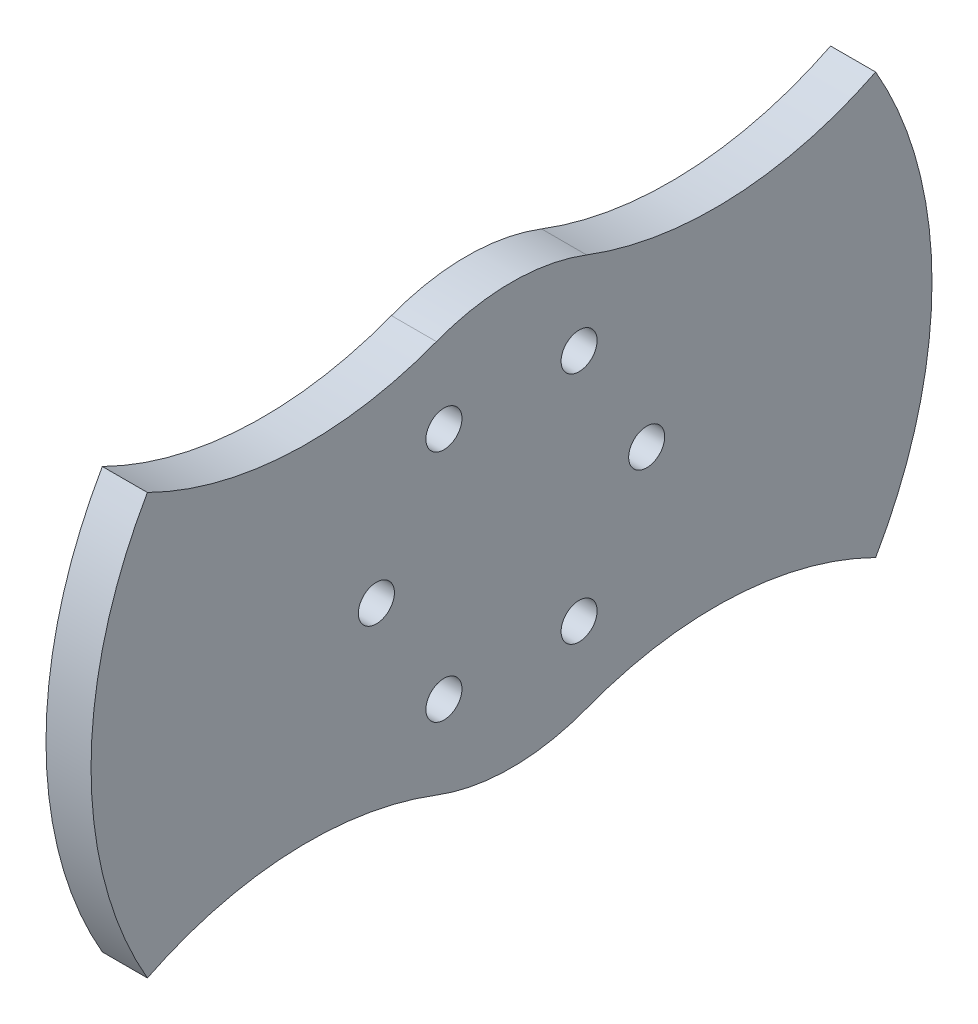
from build123d import *

# Parameters (mm, degrees)
SKETCH1_R            = 44.45
BOSS_EXTRUDE1_DEPTH  = 2.38125
CUT_EXTRUDE1_DEPTH   = 64.041941644
SKETCH3_R            = 1.905
MOUNTING_HOLES_DEPTH = 50.924287989


with BuildPart() as part:
    # Sketch1 → Boss-Extrude1 (new, symmetric)
    with BuildSketch(Plane(origin=(0, 0, 0), x_dir=(0, 0, -1), z_dir=(1, 0, 0))):
        with Locations(Location((0, 0, 0), (0, 0, 180))):
            Circle(SKETCH1_R)
    extrude(amount=BOSS_EXTRUDE1_DEPTH, both=True)

    # Sketch2 → Cut-Extrude1 (cut, through all)
    with BuildSketch(Plane(origin=(2.38125, 0, 0), x_dir=(0, 0, -1), z_dir=(1, 0, 0))):
        with BuildLine():
            ThreePointArc((-7.937372074, -20.759305132), (0, -22.225), (7.937372074, -20.759305132))
            ThreePointArc((7.937372074, -20.759305132), (23.369671575, -18.290437479), (38.494829198, -22.225))
            ThreePointArc((38.494829198, -22.225), (0, -44.45), (-38.494829198, -22.225))
            ThreePointArc((-38.494829198, -22.225), (-23.369671575, -18.290437479), (-7.937372074, -20.759305132))
        make_face()
        with BuildLine():
            ThreePointArc((-38.494829198, 22.225), (-23.369671575, 18.290437479), (-7.937372074, 20.759305132))
            ThreePointArc((-7.937372074, 20.759305132), (0, 22.225), (7.937372074, 20.759305132))
            ThreePointArc((7.937372074, 20.759305132), (23.369671575, 18.290437479), (38.494829198, 22.225))
            ThreePointArc((38.494829198, 22.225), (0, 44.45), (-38.494829198, 22.225))
        make_face()
    extrude(amount=-CUT_EXTRUDE1_DEPTH, mode=Mode.SUBTRACT)

    # Sketch3 → Mounting holes (cut, through all)
    with BuildSketch(Plane(origin=(2.38125, 0, 0), x_dir=(0, 0, -1), z_dir=(1, 0, 0))):
        with Locations((-14.2875, 0)):
            Circle(SKETCH3_R)
        with Locations((-7.14375, 12.373337957)):
            Circle(SKETCH3_R)
        with Locations((7.14375, 12.373337957)):
            Circle(SKETCH3_R)
        with Locations((14.2875, 0)):
            Circle(SKETCH3_R)
        with Locations((7.14375, -12.373337957)):
            Circle(SKETCH3_R)
        with Locations((-7.14375, -12.373337957)):
            Circle(SKETCH3_R)
    extrude(amount=-MOUNTING_HOLES_DEPTH, mode=Mode.SUBTRACT)


solid = part.part
